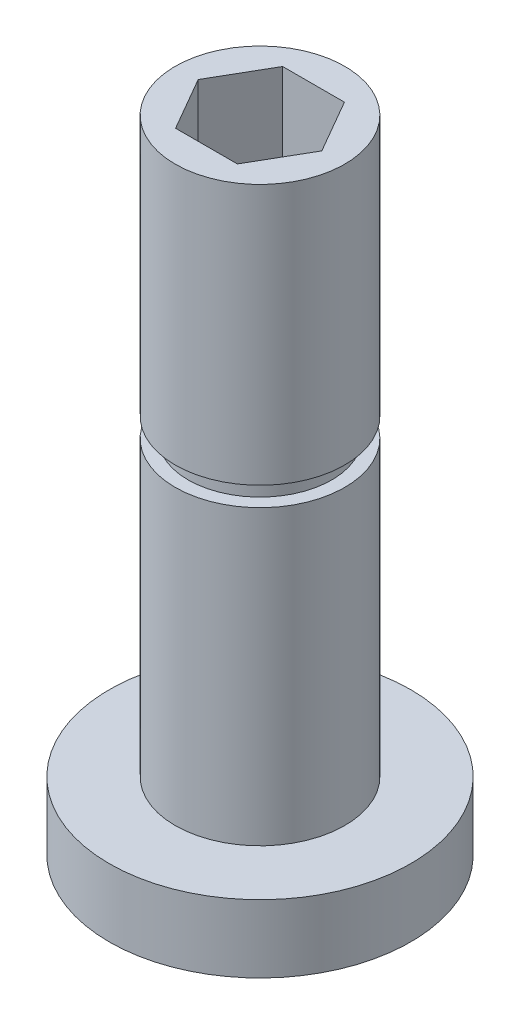
from build123d import *

# Parameters (mm, degrees)
SKETCH1_R                                     = 8.89
TRAINGULAR_BASE_SIMPLIFIED_TO_CIRCLE_HE_DEPTH = 4
SKETCH2_R                                     = 5
DRIVE_SHAFT_DEPTH                             = 33.782
SKETCH4_R                                     = 5
SKETCH4_R_2                                   = 4.238
RETAINING_RING_SLOT_DEPTH                     = 1.143
HEX_SLOT_DEPTH                                = 12.7


with BuildPart() as part:
    # Sketch1 → Traingular base (simplified to circle here) (new body)
    with BuildSketch(Plane(origin=(0, 0, 0), x_dir=(1, 0, 0), z_dir=(0, 1, 0))):
        with Locations(Location((0, 0, 0), (0, 0, 270))):
            Circle(SKETCH1_R)
    extrude(amount=TRAINGULAR_BASE_SIMPLIFIED_TO_CIRCLE_HE_DEPTH)

    # Sketch2 → Drive shaft (add)
    with BuildSketch(Plane(origin=(0, 4, 0), x_dir=(1, 0, 0), z_dir=(0, 1, 0))):
        with Locations(Location((0, 0, 0), (0, 0, 270))):
            Circle(SKETCH2_R)
    extrude(amount=DRIVE_SHAFT_DEPTH)

    # Sketch4 → Retaining ring slot (cut)
    with BuildSketch(Plane(origin=(0, 21.272, 0), x_dir=(1, 0, 0), z_dir=(0, 1, 0))):
        with Locations(Location((0, 0, 0), (0, 0, 270))):
            Circle(SKETCH4_R)
        with Locations(Location((0, 0, 0), (0, 0, 270))):
            Circle(SKETCH4_R_2, mode=Mode.SUBTRACT)
    extrude(amount=RETAINING_RING_SLOT_DEPTH, mode=Mode.SUBTRACT)

    # Sketch5 → Hex slot (cut)
    with BuildSketch(Plane(origin=(0, 37.782, 0), x_dir=(1, 0, 0), z_dir=(0, 1, 0))):
        Polygon((3.6449, 0), (1.82245, 3.156575994), (-1.82245, 3.156575994), (-3.6449, 0), (-1.82245, -3.156575994), (1.82245, -3.156575994), align=None)
    extrude(amount=-HEX_SLOT_DEPTH, mode=Mode.SUBTRACT)


solid = part.part
